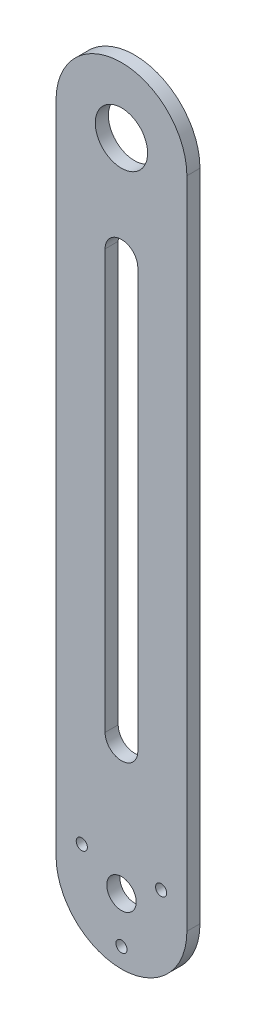
from build123d import *

# Parameters (mm, degrees)
SKETCH_1_R          = 8
SKETCH_1_R_2        = 4.5
EXTRUDE_1_DEPTH     = 4
CUT_EXTRUDE_2_DEPTH = 221.943431674
SKETCH_3_R          = 1.7
CUT_EXTRUDE_3_DEPTH = 221.943431674


with BuildPart() as part:
    # 草图1 → 凸台-拉伸1 (new body)
    with BuildSketch(Plane.XY):
        with BuildLine():
            Line((-20, 0), (-20, -200))
            ThreePointArc((-20, -200), (0, -220), (20, -200))
            Line((20, -200), (20, 0))
            ThreePointArc((20, 0), (0, 20), (-20, 0))
        make_face()
        Circle(SKETCH_1_R, mode=Mode.SUBTRACT)
        with Locations((0, -200)):
            Circle(SKETCH_1_R_2, mode=Mode.SUBTRACT)
    extrude(amount=EXTRUDE_1_DEPTH)

    # 草图2 → 切除-拉伸2 (cut, through all)
    with BuildSketch(Plane.XY.offset(4)):
        with BuildLine():
            Line((-5, -31.845004689), (-5, -159.845004689))
            ThreePointArc((-5, -159.845004689), (0, -164.845004689), (5, -159.845004689))
            Line((5, -159.845004689), (5, -31.845004689))
            ThreePointArc((5, -31.845004689), (0, -26.845004689), (-5, -31.845004689))
        make_face()
    extrude(amount=-CUT_EXTRUDE_2_DEPTH, mode=Mode.SUBTRACT)

    # 草图3 → 切除-拉伸3 (cut, through all)
    with BuildSketch(Plane(origin=(0, 0, 0), x_dir=(-1, 0, 0), z_dir=(0, 0, -1))):
        with Locations((0, -214)):
            Circle(SKETCH_3_R)
        with Locations((-12.124355653, -193)):
            Circle(SKETCH_3_R)
        with Locations((12.124355653, -193)):
            Circle(SKETCH_3_R)
    extrude(amount=-CUT_EXTRUDE_3_DEPTH, mode=Mode.SUBTRACT)


solid = part.part
